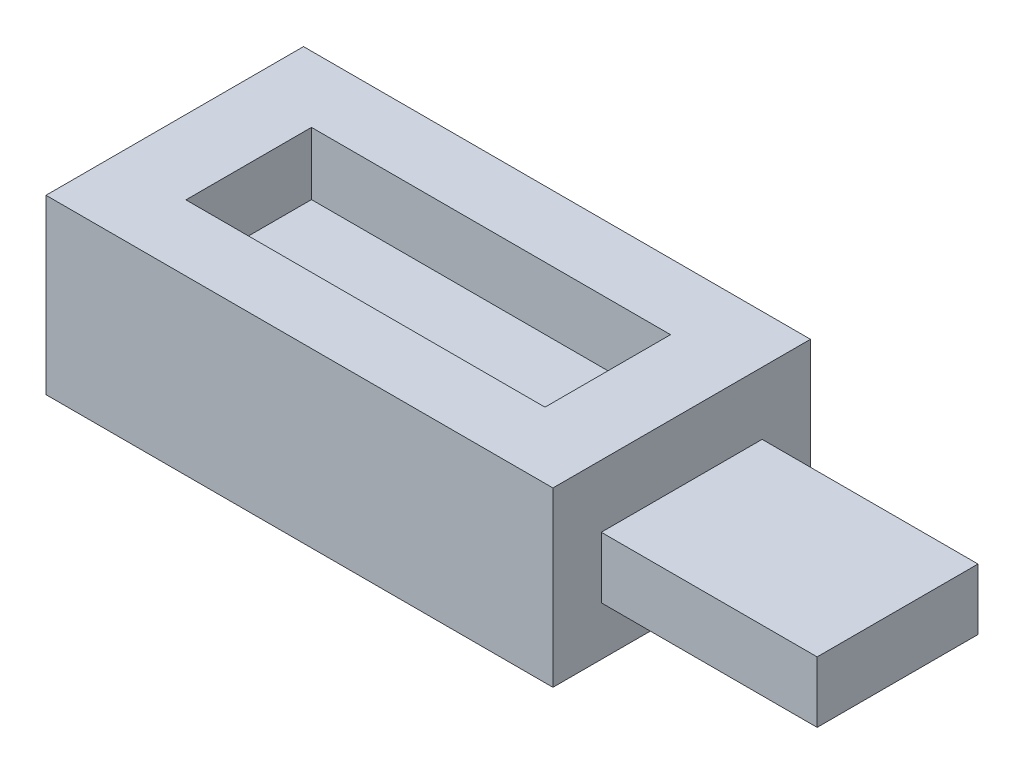
from build123d import *

# Parameters (mm, degrees)
SKETCH1_W           = 205.785682804
SKETCH1_H           = 104.534748446
BOSS_EXTRUDE1_DEPTH = 70.104
SKETCH2_W           = 145.758865666
SKETCH2_H           = 50.974097726
CUT_EXTRUDE1_DEPTH  = 25.4
SKETCH3_W           = 65.29816474
SKETCH3_H           = 24.799651417
BOSS_EXTRUDE2_DEPTH = 87.63


with BuildPart() as part:
    # Sketch1 → Boss-Extrude1 (new body)
    with BuildSketch(Plane(origin=(0, 0, 0), x_dir=(1, 0, 0), z_dir=(0, 1, 0))):
        Rectangle(SKETCH1_W, SKETCH1_H)
    extrude(amount=BOSS_EXTRUDE1_DEPTH)

    # Sketch2 → Cut-Extrude1 (cut)
    with BuildSketch(Plane(origin=(0, 70.104, 0), x_dir=(1, 0, 0), z_dir=(0, 1, 0))):
        Rectangle(SKETCH2_W, SKETCH2_H)
    extrude(amount=-CUT_EXTRUDE1_DEPTH, mode=Mode.SUBTRACT)

    # Sketch3 → Boss-Extrude2 (add)
    with BuildSketch(Plane(origin=(102.892841402, 0, 0), x_dir=(0, 0, -1), z_dir=(1, 0, 0))):
        with Locations((0, 32.321763147)):
            Rectangle(SKETCH3_W, SKETCH3_H)
    extrude(amount=BOSS_EXTRUDE2_DEPTH)


solid = part.part
